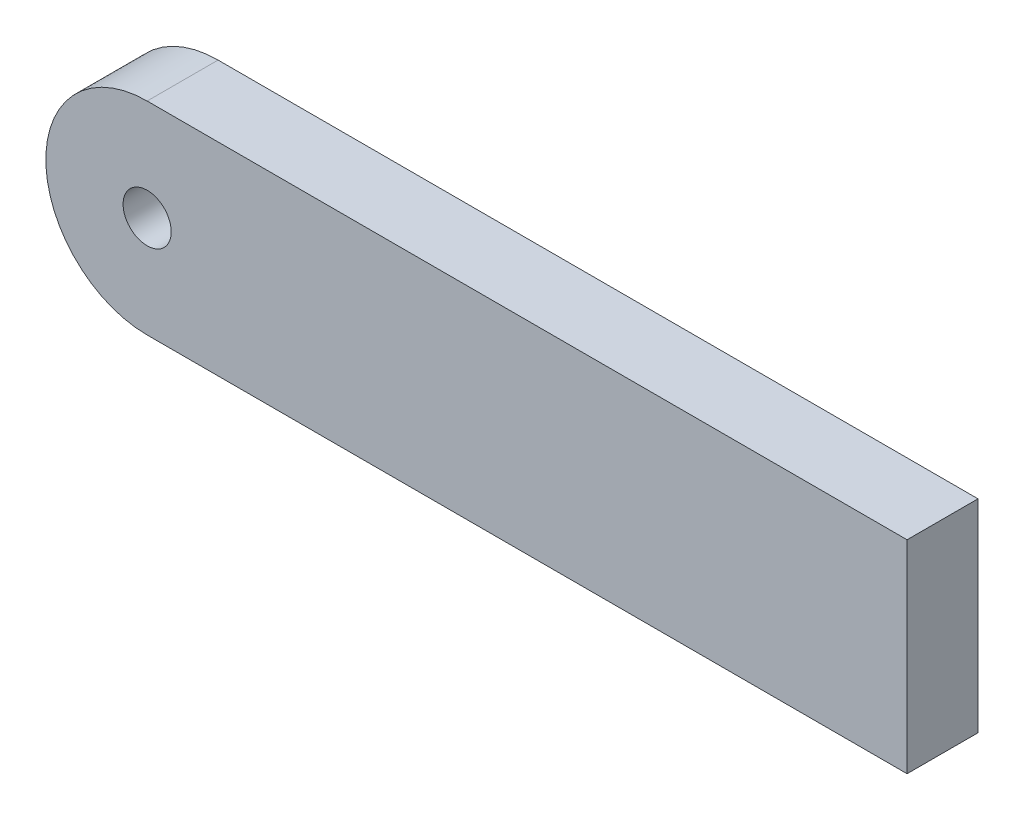
from build123d import *

# Parameters (mm, degrees)
SKETCH1_W               = 300
SKETCH1_H               = 80
BOSS_EXTRUDE1_DEPTH     = 28
SKETCH2_R               = 40
BOSS_EXTRUDE2_DEPTH     = 28
CUT_EXTRUDE2_DEPTH      = 312.743484294
CUT_EXTRUDE2_DEPTH_BACK = 312.743484294
SKETCH3_R               = 9.5


with BuildPart() as part:
    # Sketch1 → Boss-Extrude1 (new body)
    with BuildSketch(Plane.XY):
        with Locations((150, 40)):
            Rectangle(SKETCH1_W, SKETCH1_H)
    extrude(amount=BOSS_EXTRUDE1_DEPTH)

    # Sketch2 → Boss-Extrude2 (add)
    with BuildSketch(Plane.XY.offset(28)):
        with Locations((0, 40)):
            Circle(SKETCH2_R)
    extrude(amount=-BOSS_EXTRUDE2_DEPTH)

    # Sketch3 → Cut-Extrude2 (cut, two sides: drawn at the far end of the back side and taken through both)
    with BuildSketch(Plane.XY.offset(28).offset(-CUT_EXTRUDE2_DEPTH_BACK)):
        with Locations((0, 40)):
            Circle(SKETCH3_R)
    extrude(amount=CUT_EXTRUDE2_DEPTH + CUT_EXTRUDE2_DEPTH_BACK, mode=Mode.SUBTRACT)


solid = part.part
